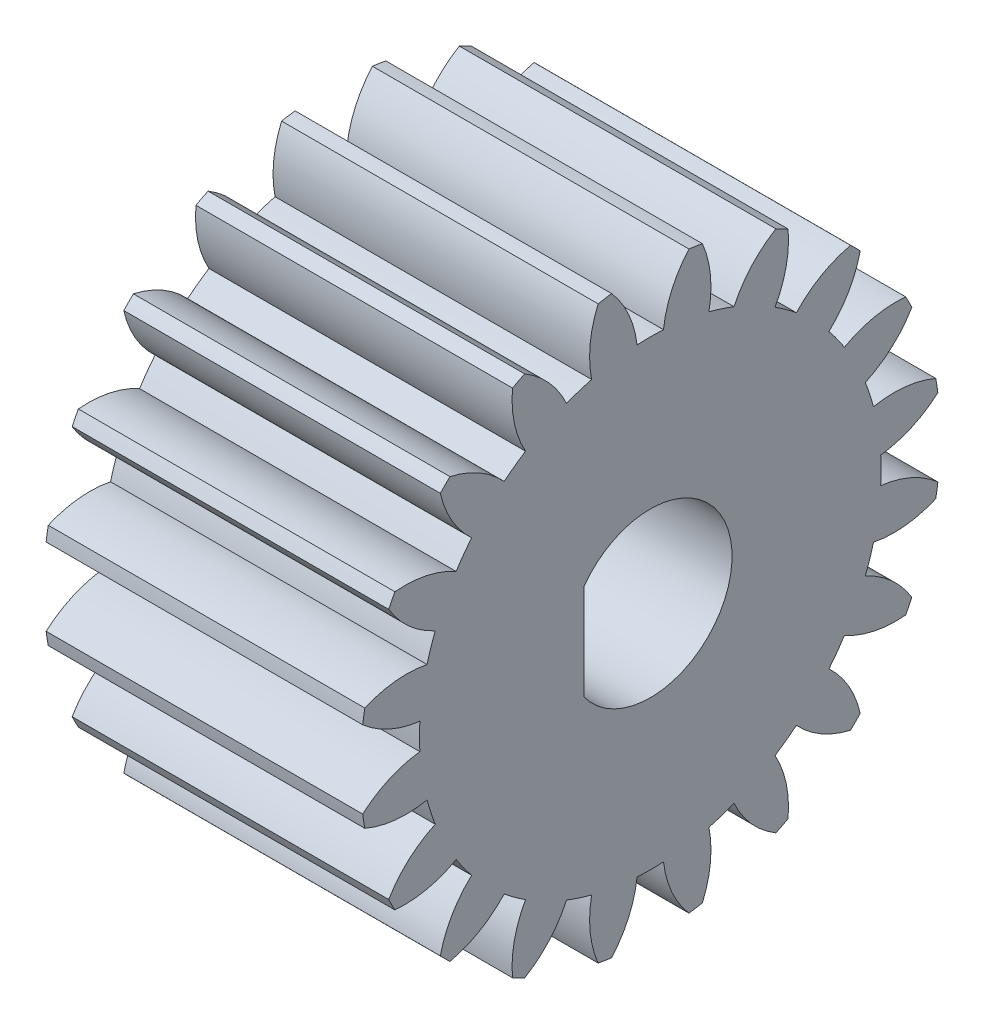
from build123d import *

# Parameters (mm, degrees)
BASPROSKE_W           = 12
BASPROSKE_H           = 11
TOOTHCUT_DEPTH        = 20.646882704
TEETHCUTS_COUNT       = 20
TEETHCUTS_ANGLE       = 342
BORSKE_R              = 0.4
BORE_DEPTH            = 50.0000508
KES_EKSTR_ZYON1_DEPTH = 20


with BuildPart() as part:
    # BasProSke → Base-Revolve (revolve)
    with BuildSketch(Plane(origin=(0, 0, 0), x_dir=(1, 0, 0), z_dir=(0, 1, 0)), mode=Mode.PRIVATE) as base_revolve_sk:
        with Locations((6, 5.5)):
            Rectangle(BASPROSKE_W, BASPROSKE_H)
    revolve(base_revolve_sk.sketch.rotate(Axis((-10, 0, 0), (1, 0, 0)), 180), axis=Axis((-10, 0, 0), (1, 0, 0)))

    # TooCutSke → ToothCut (cut, through all)
    with BuildSketch(Plane(origin=(0, 0, 0), x_dir=(0, 0, -1), z_dir=(1, 0, 0))):
        with BuildLine():
            ThreePointArc((0.499924007, 8.734705318), (0, 8.749), (-0.499924007, 8.734705318))
            ThreePointArc((-0.499924007, 8.734705318), (-0.824302243, 9.905497836), (-1.485192705, 10.924909509))
            ThreePointArc((-1.485192705, 10.924909509), (0, 11.0254), (1.485192705, 10.924909509))
            ThreePointArc((1.485192705, 10.924909509), (0.824302243, 9.905497836), (0.499924007, 8.734705318))
        make_face()
    toothcut = extrude(amount=TOOTHCUT_DEPTH, mode=Mode.SUBTRACT)

    # TeethCuts: ToothCut ×20 about axis
    teethcuts_axis = Axis((-10, 0, 0), (1, 0, 0))
    for i in range(1, TEETHCUTS_COUNT):
        add(toothcut.rotate(teethcuts_axis, i * TEETHCUTS_ANGLE / (TEETHCUTS_COUNT - 1)), mode=Mode.SUBTRACT)

    # BorSke → Bore (cut, symmetric)
    with BuildSketch(Plane(origin=(0, 0, 0), x_dir=(0, 0, -1), z_dir=(1, 0, 0))):
        with Locations(Location((0, 0, 0), (0, 0, 180))):
            Circle(BORSKE_R)
    extrude(amount=BORE_DEPTH, both=True, mode=Mode.SUBTRACT)

    # Çizim1 → Kes-Ekstrüzyon1 (cut)
    with BuildSketch(Plane(origin=(12, 0, 0), x_dir=(0, 0, -1), z_dir=(1, 0, 0))):
        with BuildLine():
            ThreePointArc((3.1, 0), (0.947900657, 2.951522378), (-2.520312481, 1.805))
            Line((-2.520312481, 1.805), (-2.520312481, -1.805))
            ThreePointArc((-2.520312481, -1.805), (0.947900657, -2.951522378), (3.1, 0))
        make_face()
    extrude(amount=-KES_EKSTR_ZYON1_DEPTH, mode=Mode.SUBTRACT)


solid = part.part
